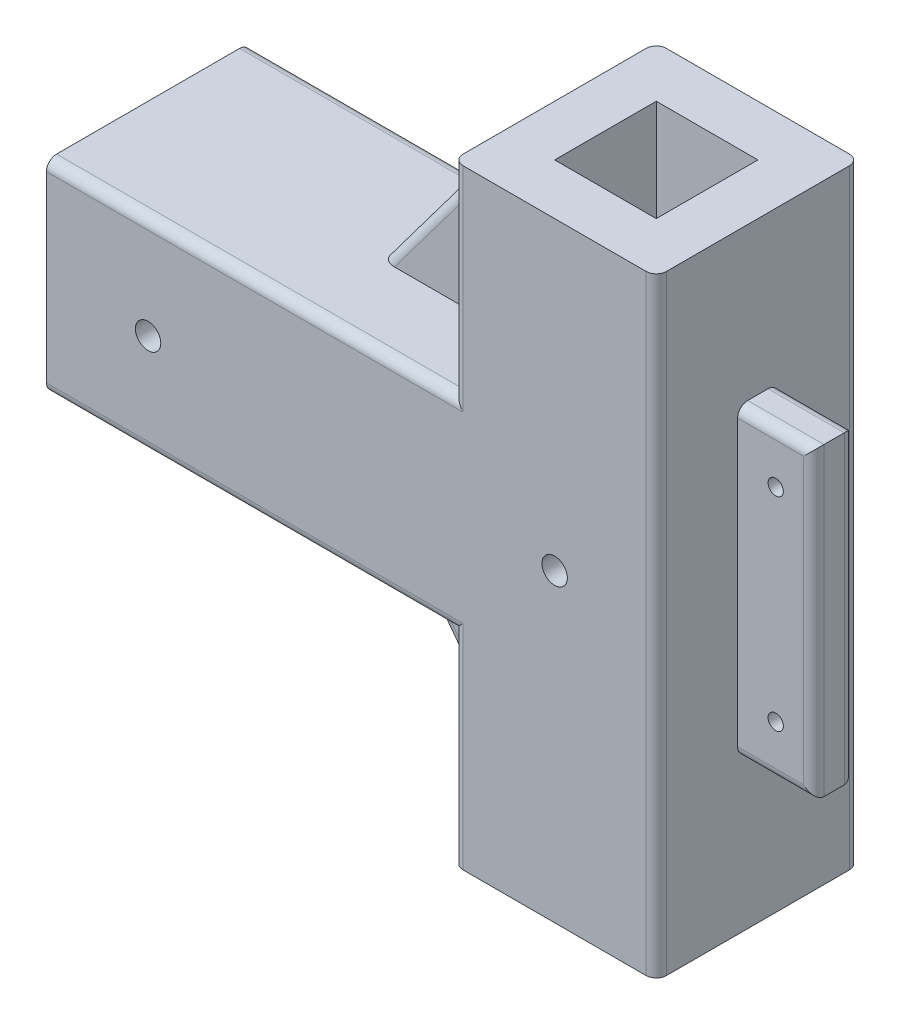
from build123d import *

# Parameters (mm, degrees)
SKETCH1_W                = 40
SKETCH1_H                = 40
SKETCH1_W_2              = 20
SKETCH1_H_2              = 20
BOSS_EXTRUDE1_DEPTH      = 120
SKETCH2_W                = 40
SKETCH2_H                = 40
SKETCH2_W_2              = 20
SKETCH2_H_2              = 20
BOSS_EXTRUDE2_DEPTH      = 80
BOSS_EXTRUDE3_DEPTH      = 4
BOSS_EXTRUDE3_DEPTH_BACK = 4
SKETCH5_R                = 1.5
SKETCH5_W                = 15
SKETCH5_H                = 60
SKETCH7_W                = 20
SKETCH7_H                = 20
CUT_EXTRUDE2_DEPTH       = 30
SKETCH8_R                = 2.5
CUT_EXTRUDE3_DEPTH       = 150.666295471
FILLET1_R                = 2
FILLET2_R                = 2
FILLET3_R                = 2
FILLET4_R                = 2
FILLET5_R                = 2


with BuildPart() as part:
    # Sketch1 → Boss-Extrude1 (new body)
    with BuildSketch(Plane(origin=(0, 0, 0), x_dir=(1, 0, 0), z_dir=(0, 1, 0))):
        with Locations((20, 20)):
            Rectangle(SKETCH1_W, SKETCH1_H)
        with Locations((20, 20)):
            Rectangle(SKETCH1_W_2, SKETCH1_H_2, mode=Mode.SUBTRACT)
    extrude(amount=BOSS_EXTRUDE1_DEPTH)

    # Sketch2 → Boss-Extrude2 (add)
    with BuildSketch(Plane.ZY):
        with Locations((-20, 60)):
            Rectangle(SKETCH2_W, SKETCH2_H)
        with Locations((-20, 60)):
            Rectangle(SKETCH2_W_2, SKETCH2_H_2, mode=Mode.SUBTRACT)
    extrude(amount=BOSS_EXTRUDE2_DEPTH)

    # Sketch5 → Boss-Extrude3 (add, two sides: drawn at the far end of the back side and taken through both)
    # profile 1 of 3: a face of its own
    with BuildSketch(Plane.XY.offset(-20).offset(-BOSS_EXTRUDE3_DEPTH_BACK)):
        Polygon((0, 120), (0, 80), (-30, 80), align=None)
        with Locations((-10, 90)):
            Circle(SKETCH5_R, mode=Mode.SUBTRACT)
    # profile 2 of 3: a face of its own
    with BuildSketch(Plane.XY.offset(-20).offset(-BOSS_EXTRUDE3_DEPTH_BACK)):
        Polygon((0, 0), (-30, 40), (0, 40), align=None)
        with Locations((-10, 30)):
            Circle(SKETCH5_R, mode=Mode.SUBTRACT)
    # profile 3 of 3: a face of its own
    with BuildSketch(Plane.XY.offset(-20).offset(-BOSS_EXTRUDE3_DEPTH_BACK)):
        with Locations((47.5, 60)):
            Rectangle(SKETCH5_W, SKETCH5_H)
        with Locations((47.5, 80)):
            Circle(SKETCH5_R, mode=Mode.SUBTRACT)
        with Locations((47.5, 40)):
            Circle(SKETCH5_R, mode=Mode.SUBTRACT)
    extrude(amount=BOSS_EXTRUDE3_DEPTH + BOSS_EXTRUDE3_DEPTH_BACK)

    # Sketch7 → Cut-Extrude2 (cut)
    with BuildSketch(Plane.ZY):
        with Locations((-20, 60)):
            Rectangle(SKETCH7_W, SKETCH7_H)
    extrude(amount=-CUT_EXTRUDE2_DEPTH, mode=Mode.SUBTRACT)

    # Sketch8 → Cut-Extrude3 (cut, through all)
    with BuildSketch(Plane.XY):
        with Locations((-60, 60)):
            Circle(SKETCH8_R)
        with Locations((20, 60)):
            Circle(SKETCH8_R)
    extrude(amount=-CUT_EXTRUDE3_DEPTH, mode=Mode.SUBTRACT)

    # Fillet1
    fillet1_edges = [part.edges().sort_by_distance(p)[0] for p in [
        (-40, 80, 0),
    ]]
    fillet(fillet1_edges, radius=FILLET1_R)

    # Fillet2
    fillet2_edges = [part.edges().sort_by_distance(p)[0] for p in [
        (-40, 80, -40),
        (-40, 40, -40),
        (-40, 40, 0),
    ]]
    fillet(fillet2_edges, radius=FILLET2_R)

    # Fillet3
    fillet3_edges = [part.edges().sort_by_distance(p)[0] for p in [
        (40, 60, -40),
        (40, 60, 0),
        (0, 21, -40),
        (0, 21, 0),
        (0, 99, -40),
        (0, 99, 0),
    ]]
    fillet(fillet3_edges, radius=FILLET3_R)

    # Fillet4
    fillet4_edges = [part.edges().sort_by_distance(p)[0] for p in [
        (47.5, 90, -24),
        (55, 60, -24),
        (47.5, 30, -24),
        (47.5, 30, -16),
        (55, 60, -16),
        (47.5, 90, -16),
    ]]
    fillet(fillet4_edges, radius=FILLET4_R)

    # Fillet5
    fillet5_edges = [part.edges().sort_by_distance(p)[0] for p in [
        (-15, 20, -24),
        (-15, 20, -16),
        (-15, 100, -24),
        (-15, 100, -16),
    ]]
    fillet(fillet5_edges, radius=FILLET5_R)


solid = part.part
